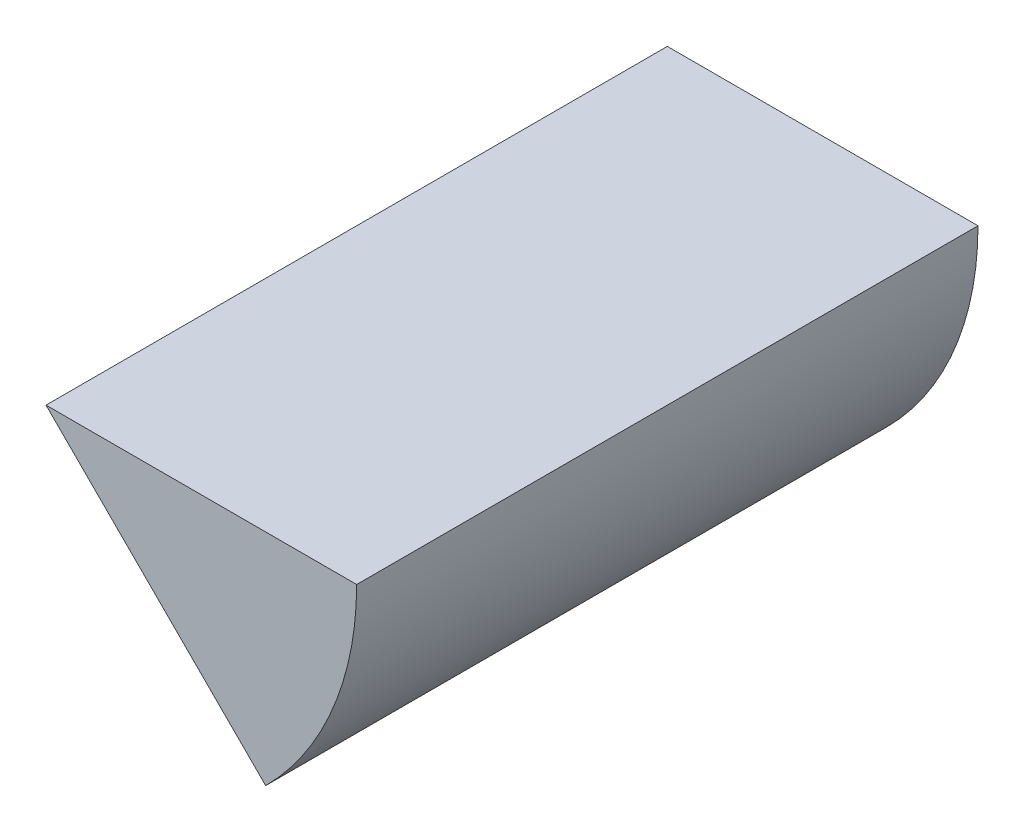
from build123d import *

# Parameters (mm, degrees)
SALIENTE_EXTRUIR1_DEPTH = 50
CROQUIS2_R              = 5
CORTAR_EXTRUIR1_DEPTH   = 10


with BuildPart() as part:
    # Croquis1 → Saliente-Extruir1 (new body)
    with BuildSketch(Plane.XY):
        with BuildLine():
            Line((25, 0), (0, 0))
            Line((0, 0), (17.67766953, -17.67766953))
            ThreePointArc((17.67766953, -17.67766953), (23.096988313, -9.567085809), (25, 0))
        make_face()
    extrude(amount=SALIENTE_EXTRUIR1_DEPTH)

    # Croquis2 → Cortar-Extruir1 (cut)
    with BuildSketch(Plane(origin=(0, 0, 0), x_dir=(-1, 0, 0), z_dir=(0, 0, -1))):
        with Locations((-16.735146408, -6.645633946)):
            Circle(CROQUIS2_R)
    extrude(amount=-CORTAR_EXTRUIR1_DEPTH, mode=Mode.SUBTRACT)


solid = part.part
